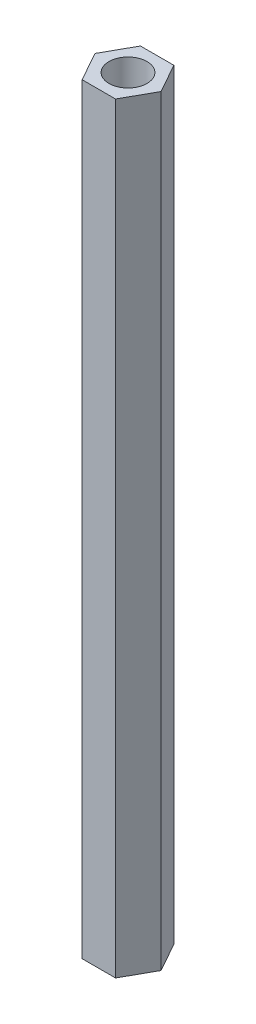
from build123d import *

# Parameters (mm, degrees)
SKETCH_1_R      = 1.5
EXTRUDE_1_DEPTH = 60


with BuildPart() as part:
    # 草图1 → 凸台-拉伸1 (new body)
    with BuildSketch(Plane(origin=(0, 0, 0), x_dir=(1, 0, 0), z_dir=(0, 1, 0))):
        Polygon((1.316857498, -2.3), (2.6, 0), (1.316857498, 2.3), (-1.316857498, 2.3), (-2.6, 0), (-1.316857498, -2.3), align=None)
        with Locations(Location((0, 0, 0), (0, 0, 270))):
            Circle(SKETCH_1_R, mode=Mode.SUBTRACT)
    extrude(amount=EXTRUDE_1_DEPTH)


solid = part.part
